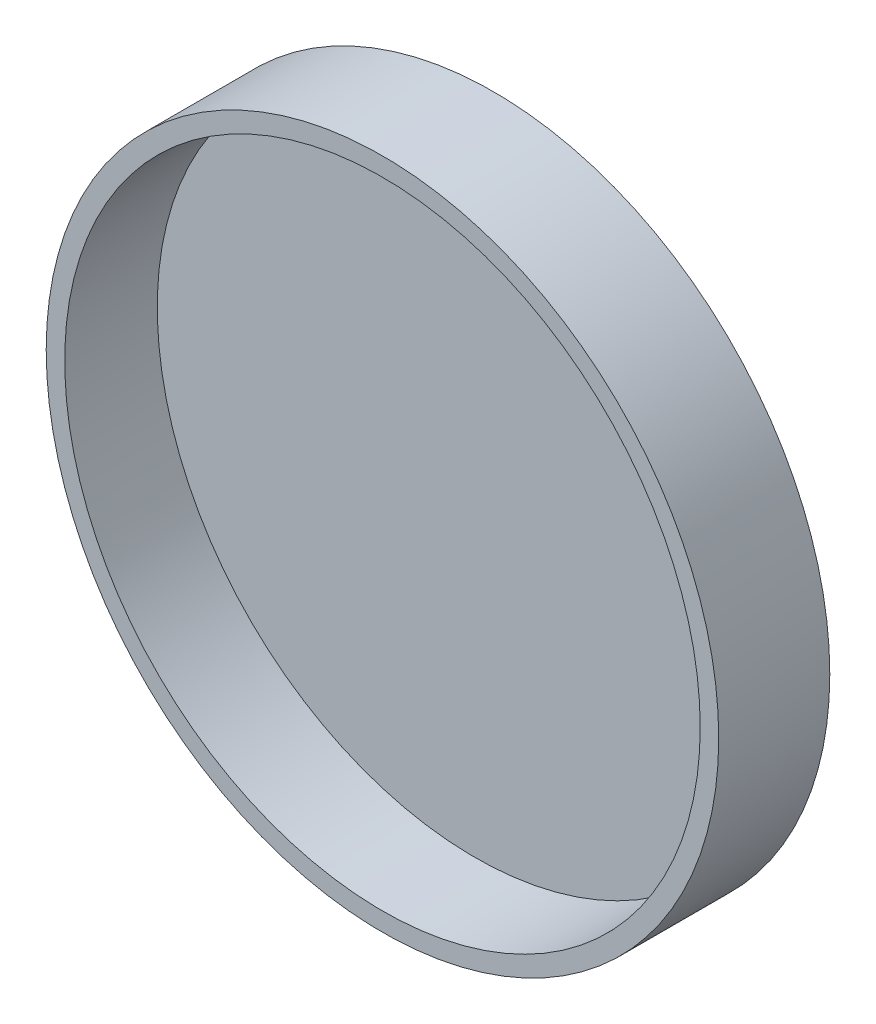
from build123d import *

# Parameters (mm, degrees)
SKETCH1_R           = 54.5
SKETCH1_R_2         = 51.5
BOSS_EXTRUDE1_DEPTH = 15
BOSS_EXTRUDE2_START = 3
SKETCH2_R           = 54.5
BOSS_EXTRUDE2_DEPTH = 3


with BuildPart() as part:
    # Sketch1 → Boss-Extrude1 (new body)
    with BuildSketch(Plane.XY):
        Circle(SKETCH1_R)
        Circle(SKETCH1_R_2, mode=Mode.SUBTRACT)
    extrude(amount=BOSS_EXTRUDE1_DEPTH)

    # Sketch2 → Boss-Extrude2 (add)
    with BuildSketch(Plane(origin=(0, 0, 0), x_dir=(-1, 0, 0), z_dir=(0, 0, -1)).offset(BOSS_EXTRUDE2_START)):
        Circle(SKETCH2_R)
    extrude(amount=-BOSS_EXTRUDE2_DEPTH)


solid = part.part
